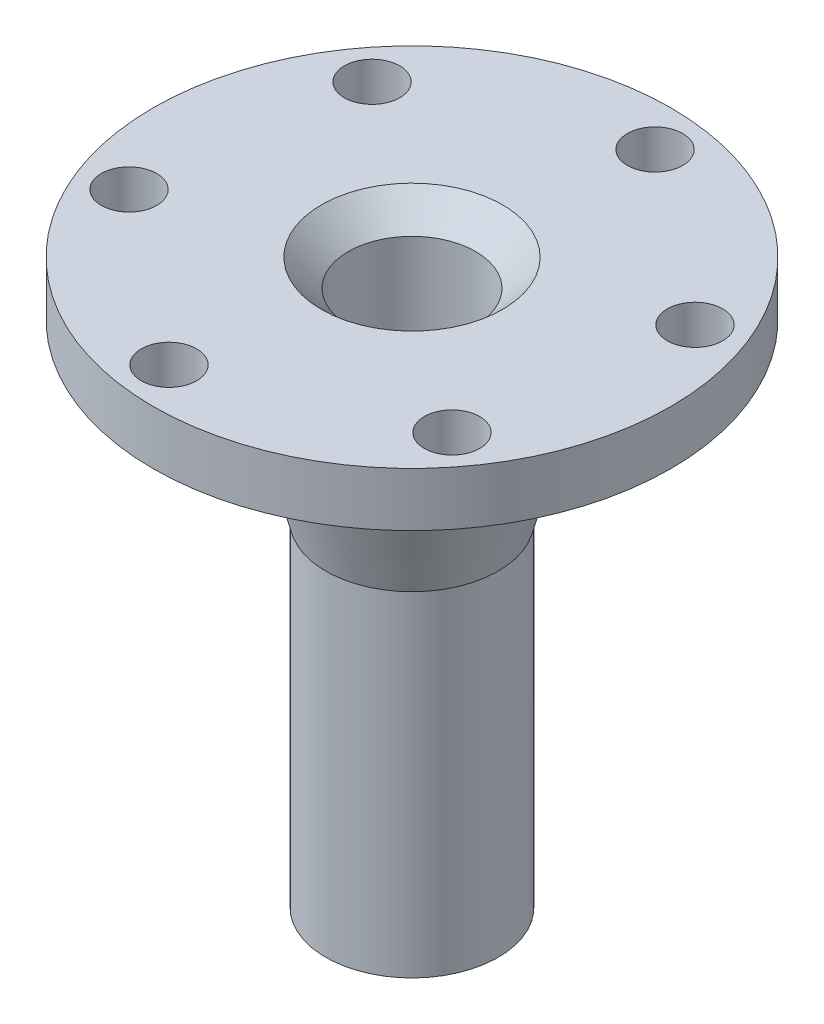
from build123d import *

# Parameters (mm, degrees)
SKETCH5_R                   = 7.5
CUT_EXTRUDE1_DEPTH          = 90
SKETCH6_R                   = 3.5
CUT_EXTRUDE2_DEPTH          = 20
CIRPATTERN1_COUNT           = 6
SKETCH11_R                  = 3.18
CUT_EXTRUDE4_DEPTH          = 101.105860558
SKETCH23_R                  = 30.48
CUT_EXTRUDE6_DEPTH          = 80.122584091
F_1_4_CLEARANCE_HOLE1_D     = 6.5278
F_1_4_CLEARANCE_HOLE1_DEPTH = 15.4203
F_1_4_CLEARANCE_HOLE1_TIP   = 1.961148974
CHAMFER1_SIZE               = 3.175


with BuildPart() as part:
    # Sketch1 → Revolve1 (revolve)
    with BuildSketch(Plane(origin=(0, 0, 0), x_dir=(0, 0, -1), z_dir=(1, 0, 0))):
        Polygon((0, 30.35), (12.7, 30.35), (12.7, 6.35), (30.48, 6.35), (30.48, 0), (15.68, 0), (10.16, -20.600920458), (10.16, -60), (0, -60), align=None)
    revolve(axis=Axis((0, 0, 0), (0, 1, 0)))

    # Sketch5 → Cut-Extrude1 (cut)
    with BuildSketch(Plane.XZ.offset(60)):
        Circle(SKETCH5_R)
    extrude(amount=-CUT_EXTRUDE1_DEPTH, mode=Mode.SUBTRACT)

    # Sketch6 → Cut-Extrude2 (cut, symmetric)
    with BuildSketch(Plane.XY):
        with Locations((0, 16.659966967)):
            Circle(SKETCH6_R)
    cut_extrude2 = extrude(amount=CUT_EXTRUDE2_DEPTH, both=True, mode=Mode.SUBTRACT)

    # CirPattern1: Cut-Extrude2 ×6 about axis
    cirpattern1_axis = Axis((0, 30.35, 0), (0, -1, 0))
    for i in range(1, CIRPATTERN1_COUNT):
        add(cut_extrude2.rotate(cirpattern1_axis, i * 360 / CIRPATTERN1_COUNT), mode=Mode.SUBTRACT)

    # Sketch11 → Cut-Extrude4 (cut, through all)
    with BuildSketch(Plane(origin=(0, 30.35, 0), x_dir=(1, 0, 0), z_dir=(0, 1, 0))):
        Circle(SKETCH11_R)
    extrude(amount=-CUT_EXTRUDE4_DEPTH, mode=Mode.SUBTRACT)

    # Sketch23 → Cut-Extrude6 (cut, through all)
    with BuildSketch(Plane(origin=(0, 6.35, 0), x_dir=(1, 0, 0), z_dir=(0, 1, 0))):
        Circle(SKETCH23_R)
    extrude(amount=CUT_EXTRUDE6_DEPTH, mode=Mode.SUBTRACT)

    # 1/4 Clearance Hole1
    with Locations(Plane(origin=(0, 6.35, 0), x_dir=(1, 0, 0), z_dir=(0, 1, 0))):
        with Locations((3.330049479, 25.294237026), (-20.240427094, 15.531025958), (23.570476573, 9.763211068), (20.240427094, -15.531025958), (-3.330049479, -25.294237026), (-23.570476573, -9.763211068)):
            Hole(F_1_4_CLEARANCE_HOLE1_D / 2, depth=F_1_4_CLEARANCE_HOLE1_DEPTH)
            with Locations((0, 0, -(F_1_4_CLEARANCE_HOLE1_DEPTH + F_1_4_CLEARANCE_HOLE1_TIP / 2))):  # 118° drill point
                Cone(0, F_1_4_CLEARANCE_HOLE1_D / 2, F_1_4_CLEARANCE_HOLE1_TIP, mode=Mode.SUBTRACT)

    # Chamfer1
    chamfer1_edges = [part.edges().sort_by_distance(p)[0] for p in [
        (-7.5, 6.35, 0),
    ]]
    chamfer(chamfer1_edges, length=CHAMFER1_SIZE)


solid = part.part
